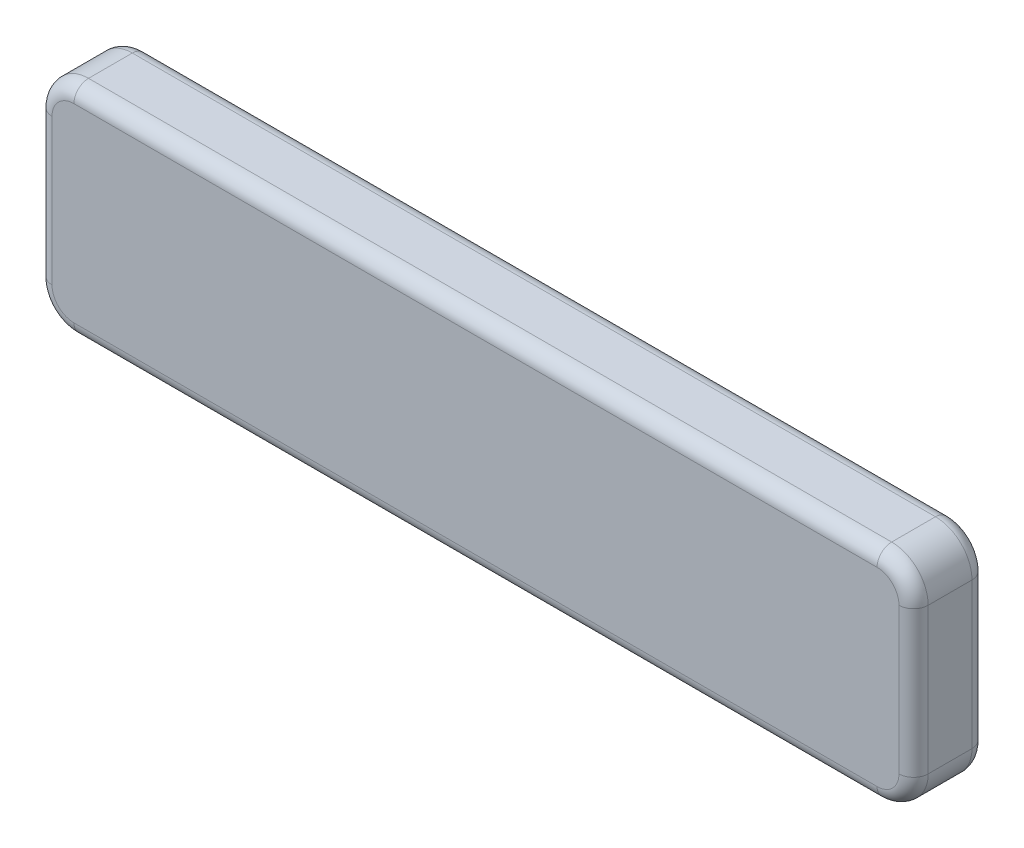
from build123d import *

# Parameters (mm, degrees)
SKETCH1_W           = 120
SKETCH1_H           = 30
BOSS_EXTRUDE1_DEPTH = 10
FILLET1_R           = 5
FILLET2_R           = 2


with BuildPart() as part:
    # Sketch1 → Boss-Extrude1 (new body)
    with BuildSketch(Plane.XY):
        Rectangle(SKETCH1_W, SKETCH1_H)
    extrude(amount=BOSS_EXTRUDE1_DEPTH)

    # Fillet1
    fillet1_edges = [part.edges().sort_by_distance(p)[0] for p in [
        (-60, 15, 5),
        (60, 15, 5),
        (60, -15, 5),
        (-60, -15, 5),
    ]]
    fillet(fillet1_edges, radius=FILLET1_R)

    # Fillet2
    fillet2_edges = [part.edges().sort_by_distance(p)[0] for p in [
        (0, -15, 0),
        (0, -15, 10),
        (-60, 0, 0),
        (0, 15, 0),
        (60, 0, 0),
        (-58.535533906, 13.535533906, 0),
        (58.535533906, 13.535533906, 0),
        (58.535533906, -13.535533906, 0),
        (-58.535533906, -13.535533906, 0),
        (-60, 0, 10),
        (60, 0, 10),
        (0, 15, 10),
        (-58.535533906, 13.535533906, 10),
        (58.535533906, 13.535533906, 10),
        (58.535533906, -13.535533906, 10),
        (-58.535533906, -13.535533906, 10),
    ]]
    fillet(fillet2_edges, radius=FILLET2_R)


solid = part.part
